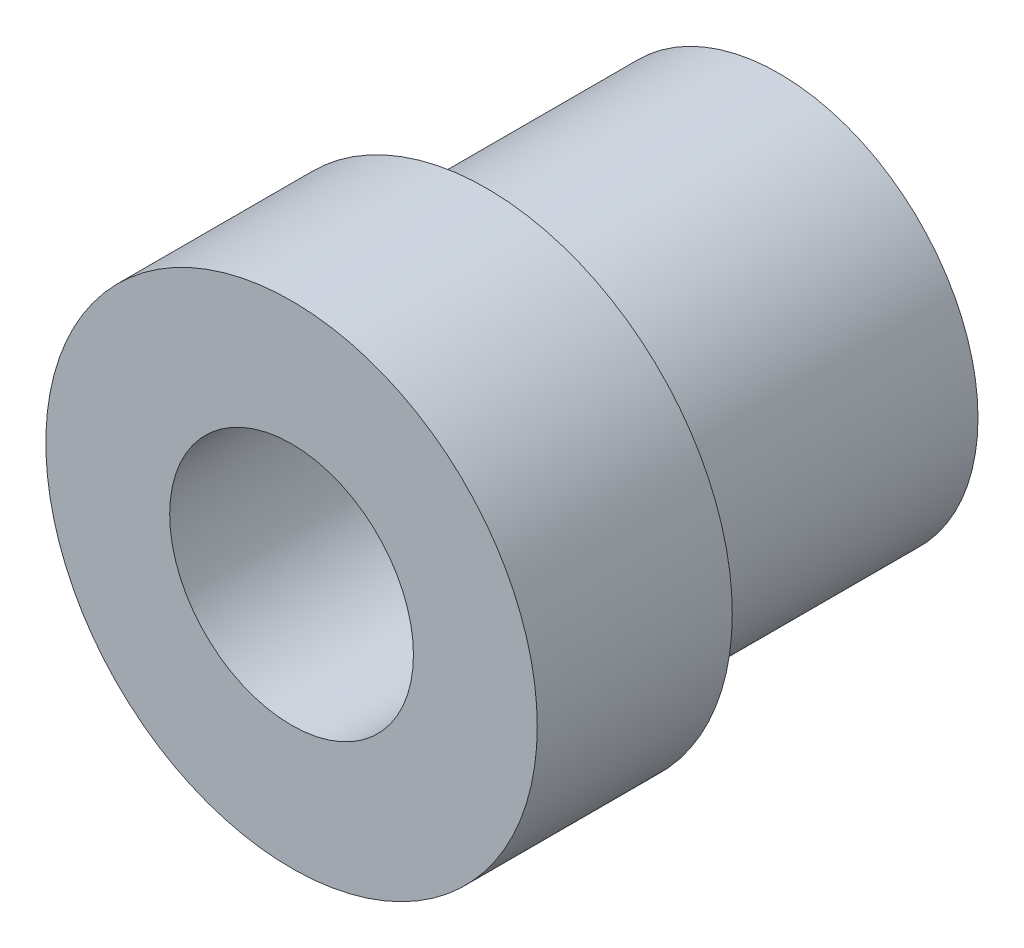
from build123d import *

# Parameters (mm, degrees)
SKETCH1_R           = 8.001
SKETCH1_R_2         = 3.96875
OUTER_DEPTH         = 6.35
BOSS_EXTRUDE2_START = -9.525
SKETCH1_3_R         = 6.477
SKETCH1_3_R_2       = 3.96875
BOSS_EXTRUDE2_DEPTH = 9.525


with BuildPart() as part:
    # Sketch1 → Outer (new body)
    with BuildSketch(Plane.XY):
        Circle(SKETCH1_R)
        Circle(SKETCH1_R_2, mode=Mode.SUBTRACT)
    extrude(amount=OUTER_DEPTH)

    # Sketch1<3> → Boss-Extrude2 (add)
    with BuildSketch(Plane.XY.offset(BOSS_EXTRUDE2_START)):
        Circle(SKETCH1_3_R)
        Circle(SKETCH1_3_R_2, mode=Mode.SUBTRACT)
    extrude(amount=BOSS_EXTRUDE2_DEPTH)


solid = part.part
